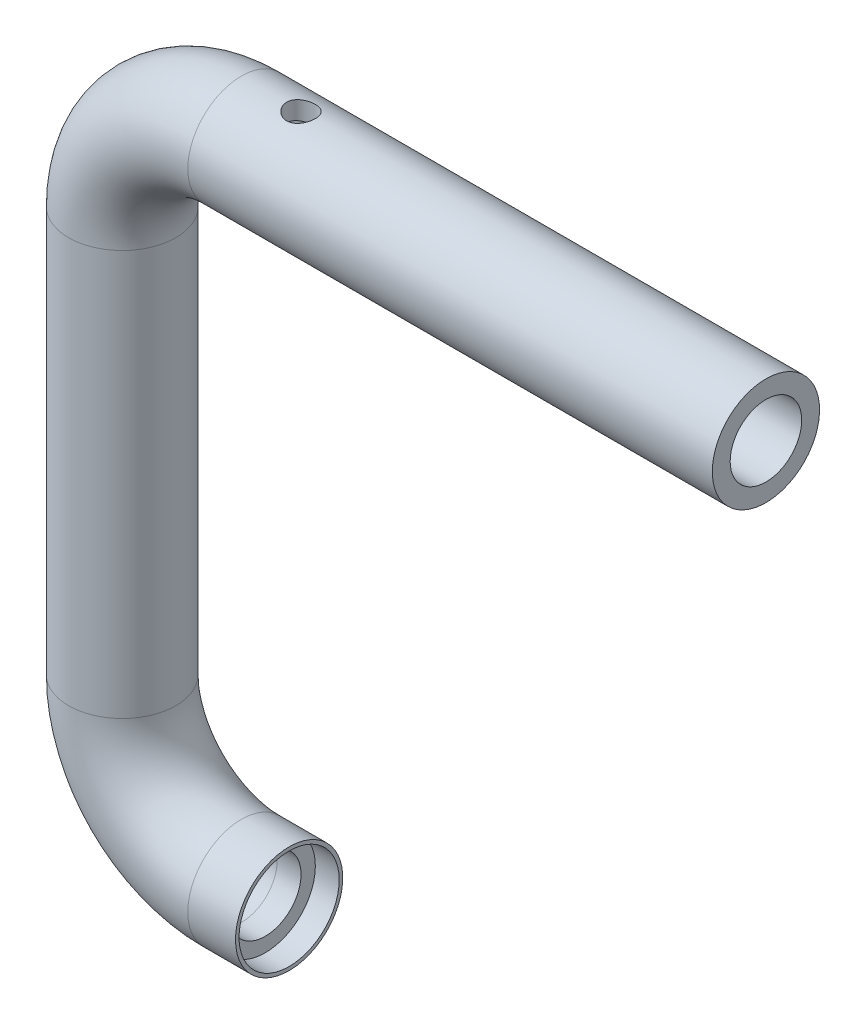
from build123d import *

# Parameters (mm, degrees)
SWEEP_THIN1_PROFILE_R   = 22.5
SWEEP_THIN1_PROFILE_R_2 = 15
SKETCH30_R              = 21
CUT_EXTRUDE1_DEPTH      = 10
SKETCH41_R              = 6
CUT_EXTRUDE3_DEPTH      = 90


with BuildPart() as part:
    # Sweep-Thin1: sweep along a path in Sketch1
    with BuildLine(Plane.XY) as sweep_thin1_path:
        Line((0, 0), (-220, 0))
        ThreePointArc((-220, 0), (-255.355339059, -14.644660941), (-270, -50))
        Line((-270, -50), (-270, -220))
        ThreePointArc((-270, -220), (-255.355339059, -255.355339059), (-220, -270))
        Line((-220, -270), (-200, -270))
    # Sweep-Thin1 profile (on start of the path) → Sweep-Thin1 (sweep)
    with BuildSketch(Plane(origin=(0, 0, 0), x_dir=(0, -1, 0), z_dir=(-1, 0, 0))):
        Circle(SWEEP_THIN1_PROFILE_R)
        Circle(SWEEP_THIN1_PROFILE_R_2, mode=Mode.SUBTRACT)
    sweep(path=sweep_thin1_path.line)

    # Sketch30 → Cut-Extrude1 (cut)
    with BuildSketch(Plane(origin=(-200, 0, 0), x_dir=(0, 0, -1), z_dir=(1, 0, 0))):
        with Locations((0, -270)):
            Circle(SKETCH30_R)
    extrude(amount=-CUT_EXTRUDE1_DEPTH, mode=Mode.SUBTRACT)

    # Sketch41 → Cut-Extrude3 (cut)
    with BuildSketch(Plane(origin=(0, 22.5, 0), x_dir=(1, 0, 0), z_dir=(0, 1, 0))):
        with Locations(Location((-195, 0, 0), (0, 0, 180))):
            Circle(SKETCH41_R)
    extrude(amount=-CUT_EXTRUDE3_DEPTH, mode=Mode.SUBTRACT)


solid = part.part
